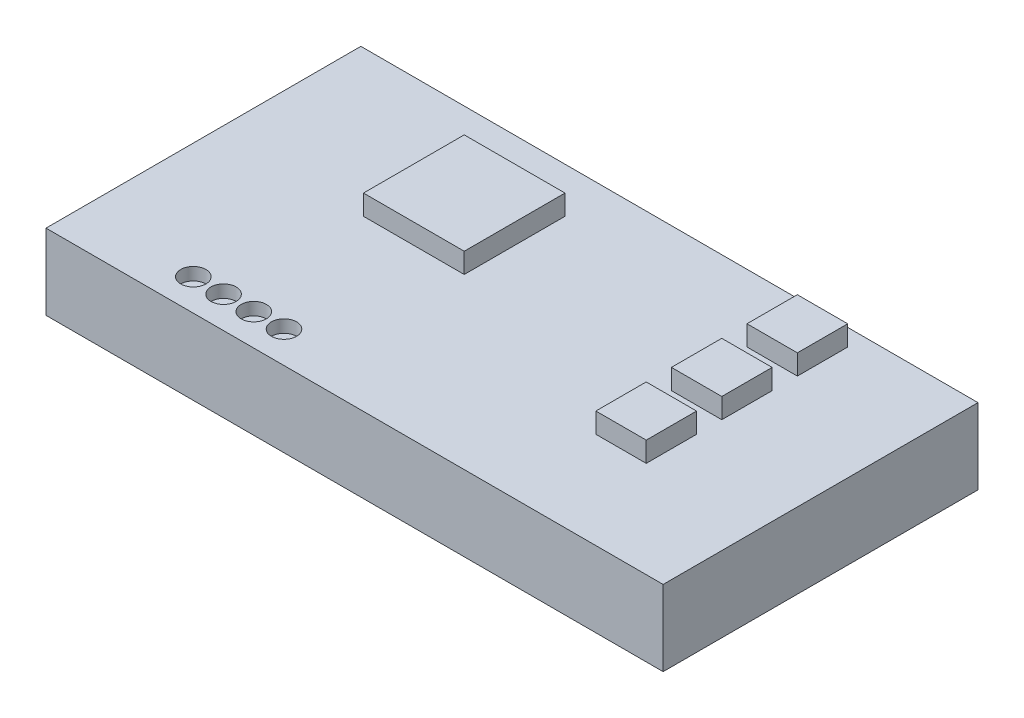
from build123d import *

# Parameters (mm, degrees)
CROQUIS1_W              = 24.5
CROQUIS1_H              = 12.5
SALIENTE_EXTRUIR1_DEPTH = 3
CROQUIS2_R              = 0.5
CORTAR_EXTRUIR1_DEPTH   = 0.5
CROQUIS3_W              = 2
CROQUIS3_H              = 1.99806337
CROQUIS3_W_2            = 4
CROQUIS3_H_2            = 4
SALIENTE_EXTRUIR2_DEPTH = 0.8


with BuildPart() as part:
    # Croquis1 → Saliente-Extruir1 (new body)
    with BuildSketch(Plane(origin=(0, 0, 0), x_dir=(1, 0, 0), z_dir=(0, 1, 0))):
        Rectangle(CROQUIS1_W, CROQUIS1_H)
    extrude(amount=SALIENTE_EXTRUIR1_DEPTH)

    # Croquis2 → Cortar-Extruir1 (cut)
    with BuildSketch(Plane(origin=(0, 3, 0), x_dir=(1, 0, 0), z_dir=(0, 1, 0))):
        with Locations(Location((-7.654869521, -4.99629776, 0), (0, 0, 270))):
            Circle(CROQUIS2_R)
        with Locations(Location((-6.454869521, -4.99629776, 0), (0, 0, 270))):
            Circle(CROQUIS2_R)
        with Locations(Location((-5.254869521, -4.99629776, 0), (0, 0, 270))):
            Circle(CROQUIS2_R)
        with Locations(Location((-4.054869521, -4.99629776, 0), (0, 0, 270))):
            Circle(CROQUIS2_R)
    extrude(amount=-CORTAR_EXTRUIR1_DEPTH, mode=Mode.SUBTRACT)

    # Croquis3 → Saliente-Extruir2 (add)
    with BuildSketch(Plane(origin=(0, 3, 0), x_dir=(1, 0, 0), z_dir=(0, 1, 0))):
        with Locations((6.752485875, 1.575565117)):
            Rectangle(CROQUIS3_W, CROQUIS3_H)
        with Locations((-4.353841516, 2.457617945)):
            Rectangle(CROQUIS3_W_2, CROQUIS3_H_2)
        with Locations((6.752485875, 4.575565117)):
            Rectangle(CROQUIS3_W, CROQUIS3_H)
        with Locations((6.752485875, -1.424434883)):
            Rectangle(CROQUIS3_W, CROQUIS3_H)
    extrude(amount=SALIENTE_EXTRUIR2_DEPTH)


solid = part.part
